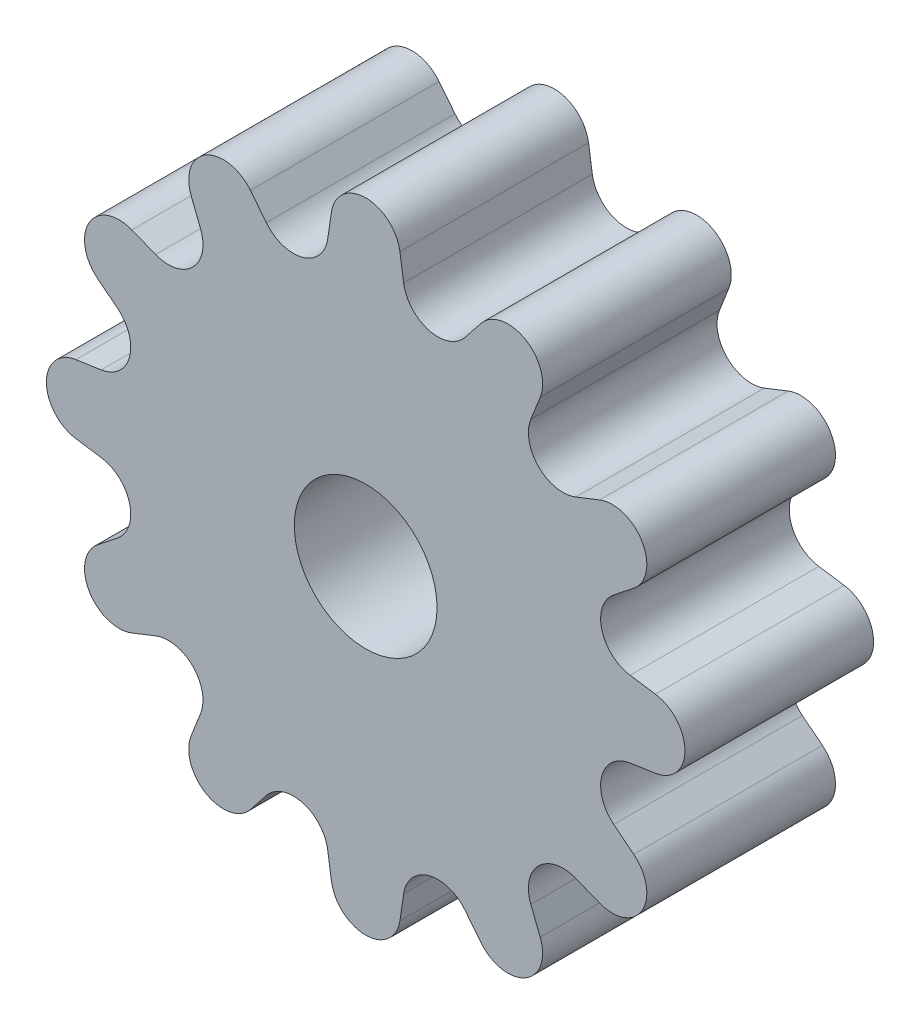
from build123d import *

# Parameters (mm, degrees)
BOSS_EXTRUDE1_DEPTH = 5.5372
SKETCH3_R           = 2.0955
CUT_EXTRUDE1_DEPTH  = 361.538157474


with BuildPart() as part:
    # Sketch2 → Boss-Extrude1 (new body)
    with BuildSketch(Plane.XY):
        with BuildLine():
            Line((300.094596165, 188.940880076), (299.62806999, 188.353043175))
            ThreePointArc((299.62806999, 188.353043175), (299.150949063, 188.019920142), (298.569281031, 188.003257744))
            ThreePointArc((298.569281031, 188.003257744), (298.073872939, 188.308521819), (297.827235612, 188.835575292))
            Line((297.827235612, 188.835575292), (297.717130543, 189.577920069))
            ThreePointArc((297.717130543, 189.577920069), (296.712124973, 190.444856977), (295.707119404, 189.577920069))
            Line((295.707119404, 189.577920069), (295.597014335, 188.835575292))
            ThreePointArc((295.597014335, 188.835575292), (295.350377008, 188.308521819), (294.854968915, 188.003257744))
            ThreePointArc((294.854968915, 188.003257744), (294.273300884, 188.019920142), (293.796179957, 188.353043175))
            Line((293.796179957, 188.353043175), (293.329653782, 188.940880076))
            ThreePointArc((293.329653782, 188.940880076), (292.025824973, 189.189166677), (291.588933073, 187.935874506))
            Line((291.588933073, 187.935874506), (291.864751675, 187.237932536))
            ThreePointArc((291.864751675, 187.237932536), (291.914684221, 186.658172176), (291.638280265, 186.146101686))
            ThreePointArc((291.638280265, 186.146101686), (291.126209774, 185.86969773), (290.546449415, 185.919630276))
            Line((290.546449415, 185.919630276), (289.848507445, 186.195448877))
            ThreePointArc((289.848507445, 186.195448877), (288.595215274, 185.758556977), (288.843501875, 184.454728169))
            Line((288.843501875, 184.454728169), (289.431338776, 183.988201994))
            ThreePointArc((289.431338776, 183.988201994), (289.764461809, 183.511081067), (289.781124207, 182.929413036))
            ThreePointArc((289.781124207, 182.929413036), (289.475860132, 182.434004943), (288.948806659, 182.187367616))
            Line((288.948806659, 182.187367616), (288.206461882, 182.077262547))
            ThreePointArc((288.206461882, 182.077262547), (287.339524973, 181.072256977), (288.206461882, 180.067251408))
            Line((288.206461882, 180.067251408), (288.948806659, 179.957146339))
            ThreePointArc((288.948806659, 179.957146339), (289.475860132, 179.710509012), (289.781124207, 179.215100919))
            ThreePointArc((289.781124207, 179.215100919), (289.764461809, 178.633432888), (289.431338776, 178.156311961))
            Line((289.431338776, 178.156311961), (288.843501875, 177.689785786))
            ThreePointArc((288.843501875, 177.689785786), (288.595215274, 176.385956977), (289.848507445, 175.949065077))
            Line((289.848507445, 175.949065077), (290.546449415, 176.224883679))
            ThreePointArc((290.546449415, 176.224883679), (291.126209774, 176.274816225), (291.638280265, 175.998412269))
            ThreePointArc((291.638280265, 175.998412269), (291.914684221, 175.486341779), (291.864751675, 174.906581419))
            Line((291.864751675, 174.906581419), (291.588933073, 174.208639449))
            ThreePointArc((291.588933073, 174.208639449), (292.025824973, 172.955347278), (293.329653782, 173.203633879))
            Line((293.329653782, 173.203633879), (293.796179957, 173.79147078))
            ThreePointArc((293.796179957, 173.79147078), (294.273300884, 174.124593813), (294.854968915, 174.141256211))
            ThreePointArc((294.854968915, 174.141256211), (295.350377008, 173.835992136), (295.597014335, 173.308938663))
            Line((295.597014335, 173.308938663), (295.707119404, 172.566593886))
            ThreePointArc((295.707119404, 172.566593886), (296.712124973, 171.699656977), (297.717130543, 172.566593886))
            Line((297.717130543, 172.566593886), (297.827235612, 173.308938663))
            ThreePointArc((297.827235612, 173.308938663), (298.073872939, 173.835992136), (298.569281031, 174.141256211))
            ThreePointArc((298.569281031, 174.141256211), (299.150949063, 174.124593813), (299.62806999, 173.79147078))
            Line((299.62806999, 173.79147078), (300.094596165, 173.203633879))
            ThreePointArc((300.094596165, 173.203633879), (301.398424973, 172.955347278), (301.835316873, 174.208639449))
            Line((301.835316873, 174.208639449), (301.559498271, 174.906581419))
            ThreePointArc((301.559498271, 174.906581419), (301.509565726, 175.486341779), (301.785969682, 175.998412269))
            ThreePointArc((301.785969682, 175.998412269), (302.298040172, 176.274816225), (302.877800532, 176.224883679))
            Line((302.877800532, 176.224883679), (303.575742502, 175.949065077))
            ThreePointArc((303.575742502, 175.949065077), (304.829034673, 176.385956977), (304.580748071, 177.689785786))
            Line((304.580748071, 177.689785786), (303.99291117, 178.156311961))
            ThreePointArc((303.99291117, 178.156311961), (303.659788137, 178.633432888), (303.64312574, 179.215100919))
            ThreePointArc((303.64312574, 179.215100919), (303.948389815, 179.710509012), (304.475443288, 179.957146339))
            Line((304.475443288, 179.957146339), (305.217788065, 180.067251408))
            ThreePointArc((305.217788065, 180.067251408), (306.084724973, 181.072256977), (305.217788065, 182.077262547))
            Line((305.217788065, 182.077262547), (304.475443288, 182.187367616))
            ThreePointArc((304.475443288, 182.187367616), (303.948389815, 182.434004943), (303.64312574, 182.929413036))
            ThreePointArc((303.64312574, 182.929413036), (303.659788137, 183.511081067), (303.99291117, 183.988201994))
            Line((303.99291117, 183.988201994), (304.580748071, 184.454728169))
            ThreePointArc((304.580748071, 184.454728169), (304.829034673, 185.758556977), (303.575742502, 186.195448877))
            Line((303.575742502, 186.195448877), (302.877800532, 185.919630276))
            ThreePointArc((302.877800532, 185.919630276), (302.298040172, 185.86969773), (301.785969682, 186.146101686))
            ThreePointArc((301.785969682, 186.146101686), (301.509565726, 186.658172176), (301.559498271, 187.237932536))
            Line((301.559498271, 187.237932536), (301.835316873, 187.935874506))
            ThreePointArc((301.835316873, 187.935874506), (301.398424973, 189.189166677), (300.094596165, 188.940880076))
        make_face()
    extrude(amount=BOSS_EXTRUDE1_DEPTH)

    # Sketch3 → Cut-Extrude1 (cut, through all)
    with BuildSketch(Plane.XY.offset(5.5372)):
        with Locations((296.712124973, 181.072256977)):
            Circle(SKETCH3_R)
    extrude(amount=-CUT_EXTRUDE1_DEPTH, mode=Mode.SUBTRACT)


solid = part.part
